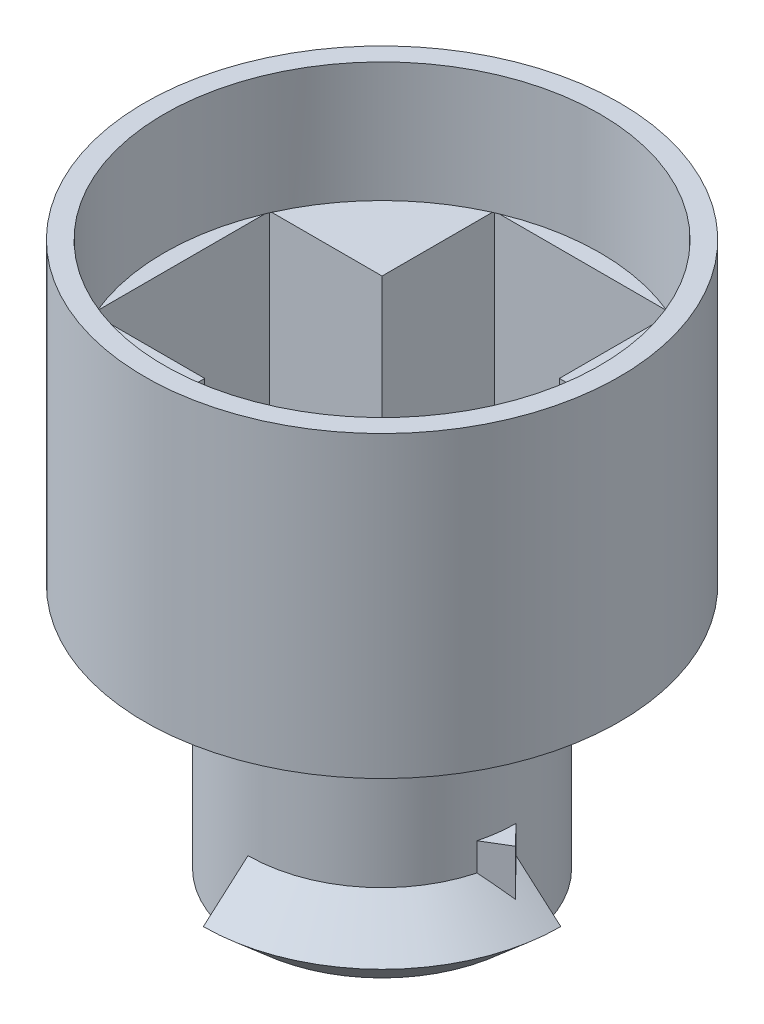
from build123d import *

# Parameters (mm, degrees)
SKETCH2_W                       = 6.35
SKETCH2_H                       = 14.4
CUT_EXTRUDE1_DEPTH              = 6.2
CIRPATTERN1_COUNT               = 4
SKETCH3_W                       = 3.2
SKETCH3_H                       = 3.2
CUT_EXTRUDE2_DEPTH              = 22.644860822
SKETCH4_W                       = 1.8
SKETCH4_H                       = 1.8
CUT_EXTRUDE3_DEPTH              = 16.9608897
FILLET1_R                       = 0.5
CIRPATTERN2_COUNT               = 4
FILLET1_OF_CIRPATTERN2_R        = 0.5
SKETCH5_R                       = 0.95
CUT_EXTRUDE4_DEPTH              = 6
REVOLVE2_ANGLE                  = 90
BOSS_EXTRUDE1_DEPTH             = 1
BOSS_EXTRUDE1_DIRECTION_2_REACH = 22.576
SKETCH8_R                       = 2.2627417
CUT_EXTRUDE5_DEPTH              = 0.6


with BuildPart() as part:
    # Sketch1 → Revolve1 (revolve)
    with BuildSketch(Plane.XY, mode=Mode.PRIVATE) as revolve1_sk:
        Polygon((0, 0), (4.8, 0), (4.8, 7), (8.5, 8.8), (8.5, 19.5), (7.8, 19.5), (7.8, 15.2), (4.25, 15.2), (4.25, 9), (4, 9), (4, 1.5), (0, 1.5), align=None)
    revolve(revolve1_sk.sketch.rotate(Axis((0, 0, 0), (0, 1, 0)), 90), axis=Axis((0, 0, 0), (0, 1, 0)))

    # Sketch2 → Cut-Extrude1 (cut)
    with BuildSketch(Plane(origin=(0, 15.2, 0), x_dir=(1, 0, 0), z_dir=(0, 1, 0))):
        Rectangle(SKETCH2_W, SKETCH2_H)
    cut_extrude1 = extrude(amount=-CUT_EXTRUDE1_DEPTH, mode=Mode.SUBTRACT)

    # CirPattern1: Cut-Extrude1 ×4 about axis
    cirpattern1_axis = Axis((0, 0, 0), (0, 1, 0))
    for i in range(1, CIRPATTERN1_COUNT):
        add(cut_extrude1.rotate(cirpattern1_axis, i * 360 / CIRPATTERN1_COUNT), mode=Mode.SUBTRACT)

    # Sketch3 → Cut-Extrude2 (cut, through all)
    with BuildSketch(Plane(origin=(0, 1.5, 0), x_dir=(1, 0, 0), z_dir=(0, 1, 0))):
        Rectangle(SKETCH3_W, SKETCH3_H)
    extrude(amount=-CUT_EXTRUDE2_DEPTH, mode=Mode.SUBTRACT)

    # Sketch4 → Cut-Extrude3 (cut, through all)
    with BuildSketch(Plane(origin=(0, 9, 0), x_dir=(1, 0, 0), z_dir=(0, 1, 0))):
        with Locations((-2.175, 6.3)):
            Rectangle(SKETCH4_W, SKETCH4_H)
        with Locations((2.175, 6.3)):
            Rectangle(SKETCH4_W, SKETCH4_H)
    cut_extrude3 = extrude(amount=-CUT_EXTRUDE3_DEPTH, mode=Mode.SUBTRACT)

    # Fillet1
    fillet1_edges = [part.edges().sort_by_distance(p)[0] for p in [
        (3.075, 8.736820818, -7.2),
        (-3.075, 8.736820818, -7.2),
    ]]
    fillet(fillet1_edges, radius=FILLET1_R)

    # CirPattern2: Cut-Extrude3 ×4 about axis
    cirpattern2_axis = Axis((0, 0, 0), (0, 1, 0))
    for i in range(1, CIRPATTERN2_COUNT):
        add(cut_extrude3.rotate(cirpattern2_axis, i * 360 / CIRPATTERN2_COUNT), mode=Mode.SUBTRACT)

    # Fillet1 of CirPattern2
    fillet1_of_cirpattern2_edges = [part.edges().sort_by_distance(p)[0] for p in [
        (-7.2, 8.736820818, -3.075),
        (-7.2, 8.736820818, 3.075),
        (-3.075, 8.736820818, 7.2),
        (3.075, 8.736820818, 7.2),
        (7.2, 8.736820818, 3.075),
        (7.2, 8.736820818, -3.075),
    ]]
    fillet(fillet1_of_cirpattern2_edges, radius=FILLET1_OF_CIRPATTERN2_R)

    # Sketch5 → Cut-Extrude4 (cut)
    with BuildSketch(Plane(origin=(0, 15.2, 0), x_dir=(1, 0, 0), z_dir=(0, 1, 0))):
        with Locations(Location((4.772970773, 4.772970773, 0), (0, 0, 270))):
            Circle(SKETCH5_R)
        with Locations(Location((-4.772970773, -4.772970773, 0), (0, 0, 270))):
            Circle(SKETCH5_R)
    extrude(amount=-CUT_EXTRUDE4_DEPTH, mode=Mode.SUBTRACT)

    # Sketch6 → Revolve2 (revolve)
    with BuildSketch(Plane(origin=(0, 0, 0), x_dir=(0, 0, -1), z_dir=(1, 0, 0))):
        Polygon((-4.8, 2.8), (-6.4, 1.4), (-4.8, 0), align=None)
        Polygon((4.8, 2.8), (4.8, 0), (6.4, 1.4), align=None)
    revolve(axis=Axis((0, 0, 0), (0, 1, 0)), revolution_arc=REVOLVE2_ANGLE)

    # Sketch7 → Boss-Extrude1 (add)
    with BuildSketch(Plane(origin=(0, 2.8, 0), x_dir=(1, 0, 0), z_dir=(0, 1, 0))):
        Polygon((4.8, 0), (5.492598815, -0.721323008), (4.637239583, -1.239358321), align=None)
        Polygon((-4.8, 0), (-4.637239583, 1.239358321), (-5.492598815, 0.721323008), align=None)
    extrude(amount=BOSS_EXTRUDE1_DEPTH)

    # Boss-Extrude1 direction 2: up to this cone (the profile starts outside it)
    boss_extrude1_direction_2_end = Plane(origin=(0, 2.8, 0), z_dir=(0, -1, 0)).offset(-4.199999) * Cone(1.143e-06, 36.658285714, 32.075999, align=(Align.CENTER, Align.CENTER, Align.MIN), mode=Mode.PRIVATE)
    # Sketch7 → Boss-Extrude1 direction 2 (add, up to the surface)
    with BuildSketch(Plane(origin=(0, 2.8, 0), x_dir=(1, 0, 0), z_dir=(0, 1, 0)), mode=Mode.PRIVATE) as boss_extrude1_direction_2_sk1:
        Polygon((4.8, 0), (5.492598815, -0.721323008), (4.637239583, -1.239358321), align=None)
    boss_extrude1_direction_2_tool1 = extrude(boss_extrude1_direction_2_sk1.sketch, amount=-BOSS_EXTRUDE1_DIRECTION_2_REACH, mode=Mode.PRIVATE) - boss_extrude1_direction_2_end
    add(boss_extrude1_direction_2_tool1.solids().sort_by_distance((4.976613, 2.8, 0.65356))[0])
    # Sketch7 → Boss-Extrude1 direction 2 (add, up to the surface)
    with BuildSketch(Plane(origin=(0, 2.8, 0), x_dir=(1, 0, 0), z_dir=(0, 1, 0)), mode=Mode.PRIVATE) as boss_extrude1_direction_2_sk2:
        Polygon((-4.8, 0), (-4.637239583, 1.239358321), (-5.492598815, 0.721323008), align=None)
    boss_extrude1_direction_2_tool2 = extrude(boss_extrude1_direction_2_sk2.sketch, amount=-BOSS_EXTRUDE1_DIRECTION_2_REACH, mode=Mode.PRIVATE) - boss_extrude1_direction_2_end
    add(boss_extrude1_direction_2_tool2.solids().sort_by_distance((-4.976613, 2.8, -0.65356))[0])

    # Sketch8 → Cut-Extrude5 (cut)
    with BuildSketch(Plane.XZ):
        with Locations(Location((0, 0, 0), (0, 0, 270))):
            Circle(SKETCH8_R)
    extrude(amount=-CUT_EXTRUDE5_DEPTH, mode=Mode.SUBTRACT)


solid = part.part
